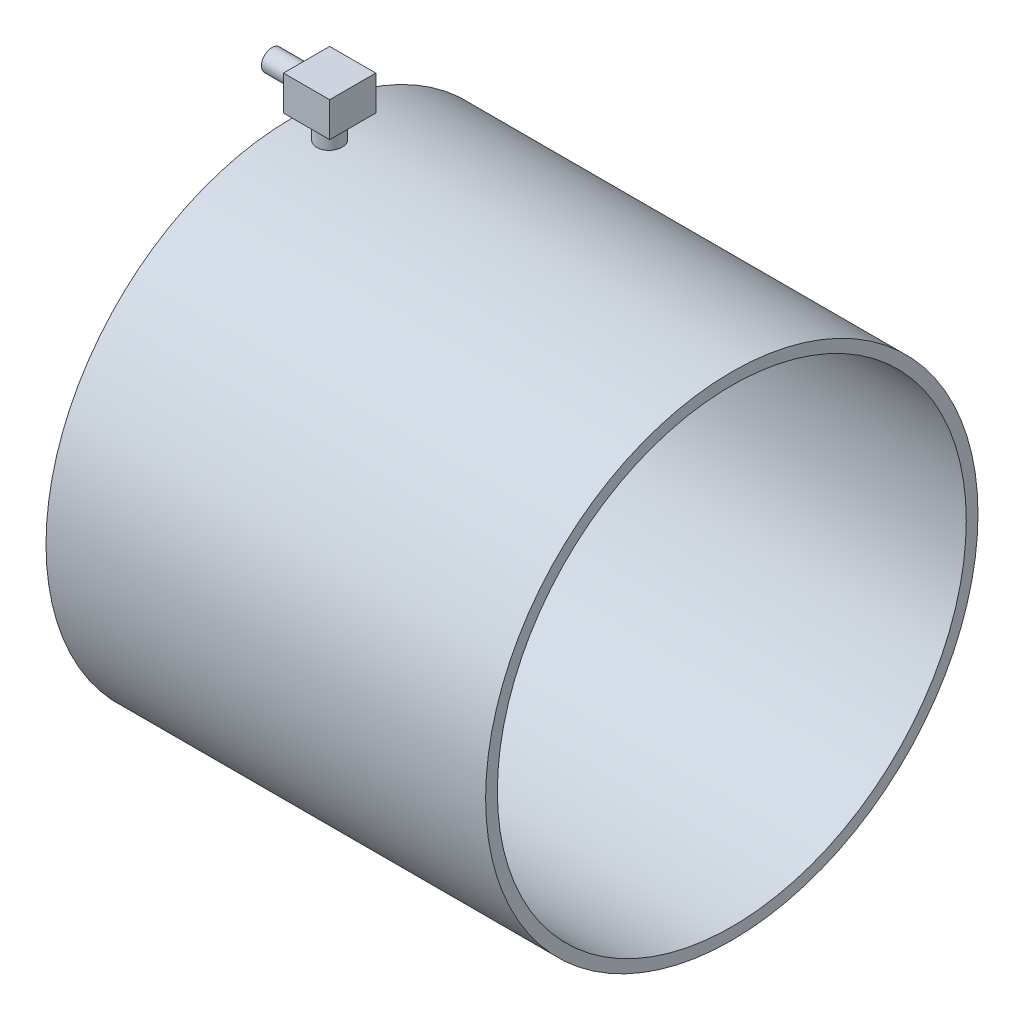
from build123d import *

# Parameters (mm, degrees)
SKETCH1_R           = 21.336
SKETCH1_R_2         = 20.32
BOSS_EXTRUDE1_DEPTH = 38.1
SKETCH2_R           = 1.104412627
BOSS_EXTRUDE2_DEPTH = 3
SKETCH3_W           = 4
SKETCH3_H           = 4
BOSS_EXTRUDE3_DEPTH = 3
SKETCH4_R           = 0.913347132
SKETCH4_R_2         = 0.661870058
BOSS_EXTRUDE4_DEPTH = 3


with BuildPart() as part:
    # Sketch1 → Boss-Extrude1 (new body)
    with BuildSketch(Plane(origin=(0, 0, 0), x_dir=(0, 0, -1), z_dir=(1, 0, 0))):
        Circle(SKETCH1_R)
        Circle(SKETCH1_R_2, mode=Mode.SUBTRACT)
    extrude(amount=BOSS_EXTRUDE1_DEPTH)


with BuildPart() as body_2:
    # Sketch2 → Boss-Extrude2 (new body)
    with BuildSketch(Plane(origin=(0, 20.330096143, 0), x_dir=(1, 0, 0), z_dir=(0, 1, 0))):
        with Locations(Location((3.244933056, 0, 0), (0, 0, 270))):
            Circle(SKETCH2_R)
    extrude(amount=BOSS_EXTRUDE2_DEPTH)

    # Sketch3 → Boss-Extrude3 (add)
    with BuildSketch(Plane(origin=(0, 23.330096143, 0), x_dir=(1, 0, 0), z_dir=(0, 1, 0))):
        with Locations((3.244933056, 0)):
            Rectangle(SKETCH3_W, SKETCH3_H)
    extrude(amount=BOSS_EXTRUDE3_DEPTH)

    # Sketch4 → Boss-Extrude4 (add)
    with BuildSketch(Plane.ZY.offset(-1.244933056)):
        with Locations(Location((0, 24.83009614, 0), (0, 0, 180))):
            Circle(SKETCH4_R)
        with Locations((0, 24.83009614)):
            Circle(SKETCH4_R_2, mode=Mode.SUBTRACT)
    extrude(amount=BOSS_EXTRUDE4_DEPTH)


solid = Compound([part.part, body_2.part])
